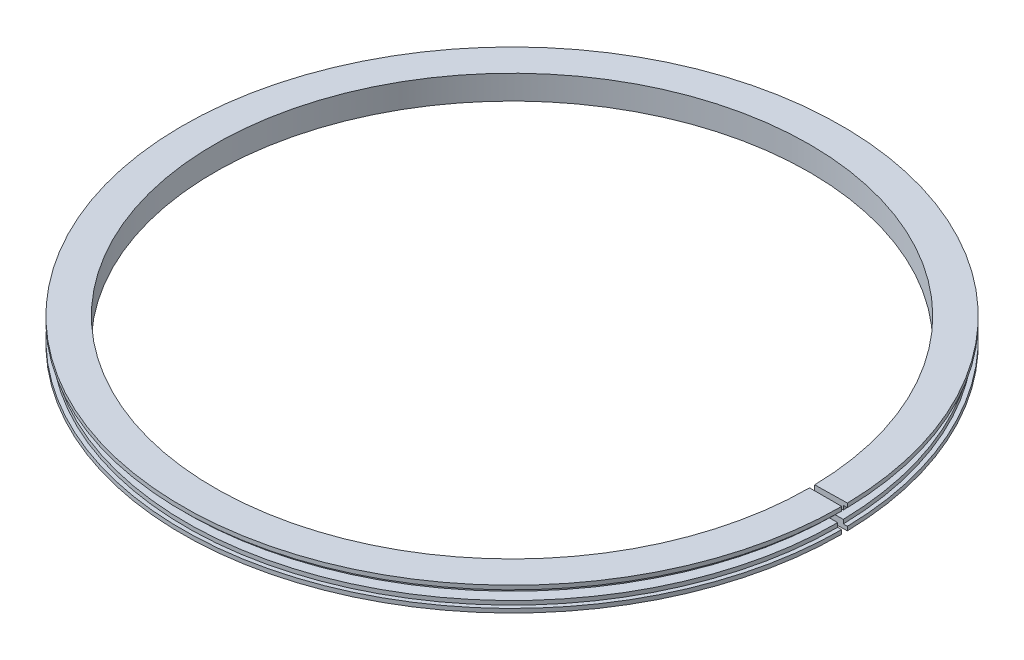
from build123d import *

# Parameters (mm, degrees)
REVOLVE_1_ANGLE = 359


with BuildPart() as part:
    # 草图1 → 旋转1 (revolve)
    with BuildSketch(Plane.XY):
        Polygon((41, 3), (41, 2.5), (40.5, 2.5), (40.5, 2), (38.5, 2), (38.5, 1), (40.5, 1), (40.5, 0.5), (41, 0.5), (41, 0), (37, 0), (37, 3), align=None)
    revolve(axis=Axis((0, 14.493134848, 0), (0, -1, 0)), revolution_arc=REVOLVE_1_ANGLE)


solid = part.part
